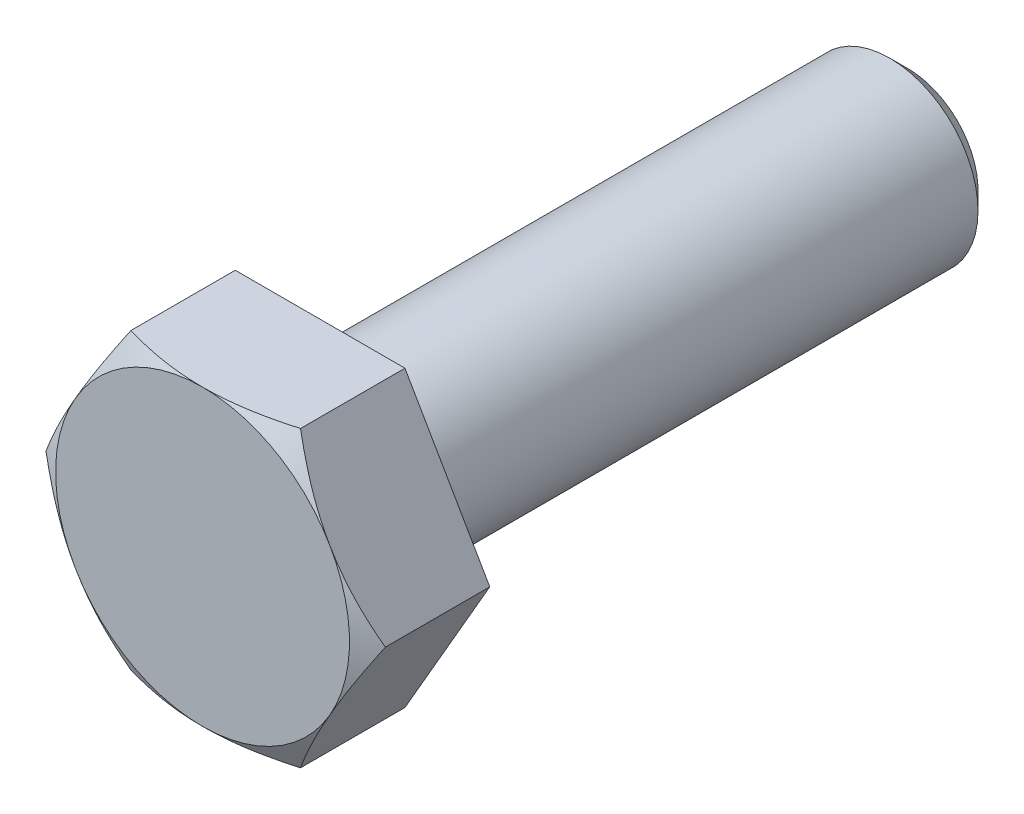
from build123d import *

# Parameters (mm, degrees)
BASE_EXTRUDE_DEPTH  = 4
SKETCH3_R           = 3
BOSS_EXTRUDE1_DEPTH = 20
CHAMFER1_SIZE       = 0.6134
FILLET1_R           = 0.25


with BuildPart() as part:
    # Sketch1 → Base-Extrude (new body)
    with BuildSketch(Plane.XY):
        Polygon((-2.886751346, 5), (2.886751346, 5), (5.773502692, 0), (2.886751346, -5), (-2.886751346, -5), (-5.773502692, 0), align=None)
    extrude(amount=BASE_EXTRUDE_DEPTH)

    # Sketch5 → Cut-Revolve1 (revolve, cut)
    with BuildSketch(Plane(origin=(0, 0, 0), x_dir=(1, 0, 0), z_dir=(0, 1, 0))):
        Polygon((-5.773502692, -4), (-5, -4), (-5.773502692, -3.553418013), align=None)
    revolve(axis=Axis((0, 0, 0), (0, 0, 1)), mode=Mode.SUBTRACT)

    # Sketch3 → Boss-Extrude1 (add)
    with BuildSketch(Plane(origin=(0, 0, 0), x_dir=(-1, 0, 0), z_dir=(0, 0, -1))):
        with Locations(Location((0, 0, 0), (0, 0, 180))):
            Circle(SKETCH3_R)
    extrude(amount=BOSS_EXTRUDE1_DEPTH)

    # Chamfer1
    chamfer1_edges = [part.edges().sort_by_distance(p)[0] for p in [
        (-3, 0, -20),
    ]]
    chamfer(chamfer1_edges, length=CHAMFER1_SIZE)

    # Fillet1
    fillet1_edges = [part.edges().sort_by_distance(p)[0] for p in [
        (-3, 0, 0),
    ]]
    fillet(fillet1_edges, radius=FILLET1_R)


solid = part.part
